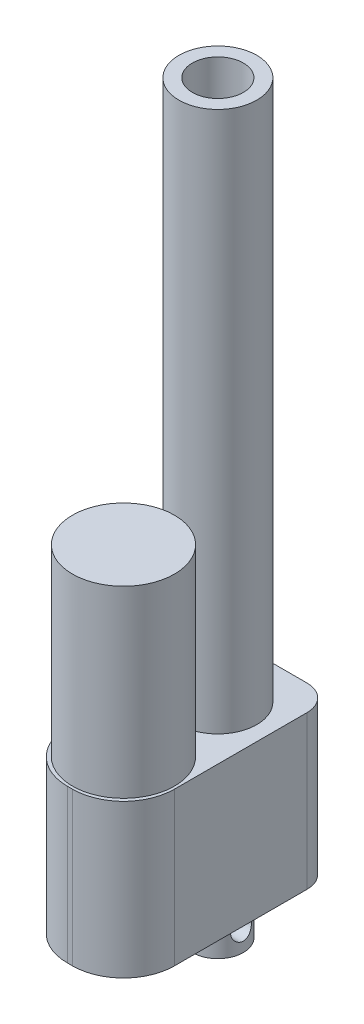
from build123d import *

# Parameters (mm, degrees)
SKETCH1_R      = 15.25
EXTRUDE1_DEPTH = 212
EXTRUDE2_DEPTH = 60
SKETCH3_R      = 20
EXTRUDE3_DEPTH = 72
SKETCH4_R      = 10
EXTRUDE4_DEPTH = 20
SKETCH5_R      = 4.1
EXTRUDE5_DEPTH = 15
SKETCH6_R      = 10
EXTRUDE6_DEPTH = 150
FILLET_1_R     = 10


with BuildPart() as part:
    # Sketch1 → Extrude1 (new body)
    with BuildSketch(Plane(origin=(0, 0, 0), x_dir=(1, 0, 0), z_dir=(0, 1, 0))):
        with Locations(Location((0, 0, 0), (0, 0, 270))):
            Circle(SKETCH1_R)
    extrude(amount=EXTRUDE1_DEPTH)

    # Sketch2 → Extrude2 (add)
    with BuildSketch(Plane.XZ):
        with BuildLine():
            Line((-1, 58), (1, 58))
            ThreePointArc((1, 58), (15.142135624, 52.142135624), (21, 38))
            Line((21, 38), (21, -24))
            Line((21, -24), (-21, -24))
            Line((-21, -24), (-21, 38))
            ThreePointArc((-21, 38), (-15.142135624, 52.142135624), (-1, 58))
        make_face()
    extrude(amount=EXTRUDE2_DEPTH)

    # Sketch3 → Extrude3 (add)
    with BuildSketch(Plane(origin=(0, 0, 0), x_dir=(1, 0, 0), z_dir=(0, 1, 0))):
        with Locations(Location((0, -37, 0), (0, 0, 90))):
            Circle(SKETCH3_R)
    extrude(amount=EXTRUDE3_DEPTH)

    # Sketch4 → Extrude4 (add)
    with BuildSketch(Plane.XZ.offset(60)):
        with Locations(Location((0, 0, 0), (0, 0, 270))):
            Circle(SKETCH4_R)
    extrude(amount=EXTRUDE4_DEPTH)

    # Sketch5 → Extrude5 (cut, symmetric)
    with BuildSketch(Plane(origin=(0, 0, 0), x_dir=(0, 0, -1), z_dir=(1, 0, 0))):
        with Locations((0, -72)):
            Circle(SKETCH5_R)
    extrude(amount=EXTRUDE5_DEPTH, both=True, mode=Mode.SUBTRACT)

    # Sketch6 → Extrude6 (cut)
    with BuildSketch(Plane(origin=(0, 212, 0), x_dir=(1, 0, 0), z_dir=(0, 1, 0))):
        with Locations(Location((0, 0, 0), (0, 0, 90))):
            Circle(SKETCH6_R)
    extrude(amount=-EXTRUDE6_DEPTH, mode=Mode.SUBTRACT)

    # Скругление1
    fillet_1_edges = [part.edges().sort_by_distance(p)[0] for p in [
        (21, -30, -24),
        (-21, -30, -24),
    ]]
    fillet(fillet_1_edges, radius=FILLET_1_R)


solid = part.part
